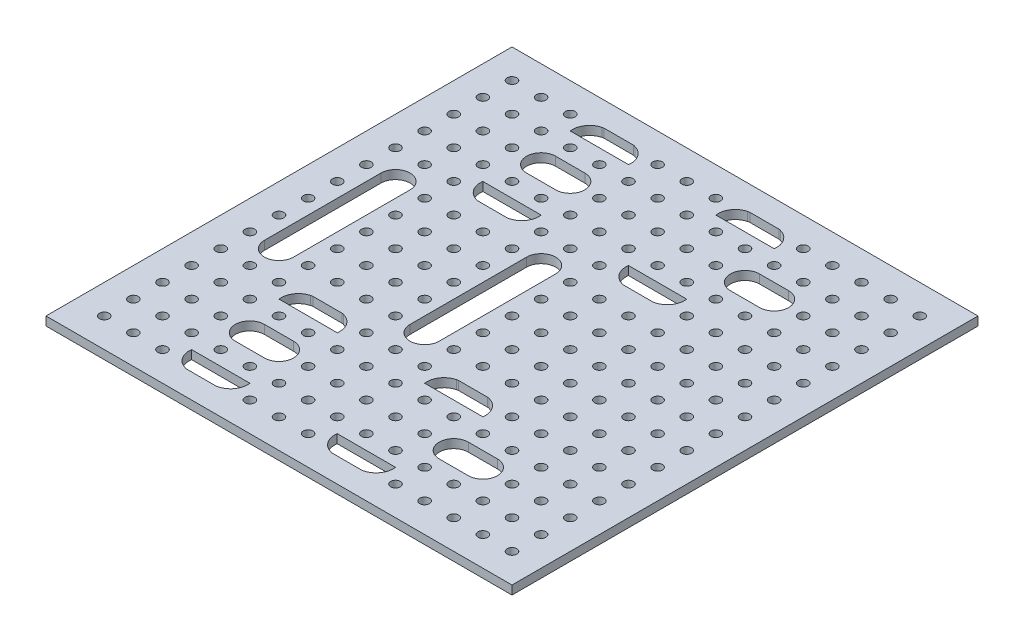
from build123d import *

# Parameters (mm, degrees)
SKETCH_1_W          = 160
SKETCH_1_H          = 160
EXTRUDE_1_DEPTH     = 3
SKETCH_3_R          = 1.65
CUT_EXTRUDE_1_DEPTH = 3
CUT_EXTRUDE_2_DEPTH = 10


with BuildPart() as part:
    # 草图1 → 凸台-拉伸1 (new body)
    with BuildSketch(Plane(origin=(0, 0, 0), x_dir=(1, 0, 0), z_dir=(0, 1, 0))):
        Rectangle(SKETCH_1_W, SKETCH_1_H)
    extrude(amount=EXTRUDE_1_DEPTH)

    # 草图3 → 切除-拉伸1 (cut)
    with BuildSketch(Plane(origin=(0, 3, 0), x_dir=(1, 0, 0), z_dir=(0, 1, 0))):
        with Locations(Location((-70, 70, 0), (0, 0, 270))):
            Circle(SKETCH_3_R)
        with Locations(Location((-60, 70, 0), (0, 0, 270))):
            Circle(SKETCH_3_R)
        with Locations(Location((-50, 70, 0), (0, 0, 270))):
            Circle(SKETCH_3_R)
        with Locations(Location((-40, 70, 0), (0, 0, 270))):
            Circle(SKETCH_3_R)
        with Locations(Location((-30, 70, 0), (0, 0, 270))):
            Circle(SKETCH_3_R)
        with Locations(Location((-20, 70, 0), (0, 0, 270))):
            Circle(SKETCH_3_R)
        with Locations(Location((-10, 70, 0), (0, 0, 270))):
            Circle(SKETCH_3_R)
        with Locations(Location((0, 70, 0), (0, 0, 270))):
            Circle(SKETCH_3_R)
        with Locations(Location((10, 70, 0), (0, 0, 270))):
            Circle(SKETCH_3_R)
        with Locations(Location((20, 70, 0), (0, 0, 270))):
            Circle(SKETCH_3_R)
        with Locations(Location((30, 70, 0), (0, 0, 270))):
            Circle(SKETCH_3_R)
        with Locations(Location((40, 70, 0), (0, 0, 270))):
            Circle(SKETCH_3_R)
        with Locations(Location((50, 70, 0), (0, 0, 270))):
            Circle(SKETCH_3_R)
        with Locations(Location((60, 70, 0), (0, 0, 270))):
            Circle(SKETCH_3_R)
        with Locations(Location((70, 70, 0), (0, 0, 270))):
            Circle(SKETCH_3_R)
        with Locations(Location((-60, 60, 0), (0, 0, 270))):
            Circle(SKETCH_3_R)
        with Locations(Location((-50, 60, 0), (0, 0, 270))):
            Circle(SKETCH_3_R)
        with Locations(Location((-40, 60, 0), (0, 0, 270))):
            Circle(SKETCH_3_R)
        with Locations(Location((-30, 60, 0), (0, 0, 270))):
            Circle(SKETCH_3_R)
        with Locations(Location((-20, 60, 0), (0, 0, 270))):
            Circle(SKETCH_3_R)
        with Locations(Location((-10, 60, 0), (0, 0, 270))):
            Circle(SKETCH_3_R)
        with Locations(Location((0, 60, 0), (0, 0, 270))):
            Circle(SKETCH_3_R)
        with Locations(Location((10, 60, 0), (0, 0, 270))):
            Circle(SKETCH_3_R)
        with Locations(Location((20, 60, 0), (0, 0, 270))):
            Circle(SKETCH_3_R)
        with Locations(Location((30, 60, 0), (0, 0, 270))):
            Circle(SKETCH_3_R)
        with Locations(Location((40, 60, 0), (0, 0, 270))):
            Circle(SKETCH_3_R)
        with Locations(Location((50, 60, 0), (0, 0, 270))):
            Circle(SKETCH_3_R)
        with Locations(Location((60, 60, 0), (0, 0, 270))):
            Circle(SKETCH_3_R)
        with Locations(Location((70, 60, 0), (0, 0, 270))):
            Circle(SKETCH_3_R)
        with Locations(Location((-60, 50, 0), (0, 0, 270))):
            Circle(SKETCH_3_R)
        with Locations(Location((-50, 50, 0), (0, 0, 270))):
            Circle(SKETCH_3_R)
        with Locations(Location((-40, 50, 0), (0, 0, 270))):
            Circle(SKETCH_3_R)
        with Locations(Location((-30, 50, 0), (0, 0, 270))):
            Circle(SKETCH_3_R)
        with Locations(Location((-20, 50, 0), (0, 0, 270))):
            Circle(SKETCH_3_R)
        with Locations(Location((-10, 50, 0), (0, 0, 270))):
            Circle(SKETCH_3_R)
        with Locations(Location((0, 50, 0), (0, 0, 270))):
            Circle(SKETCH_3_R)
        with Locations(Location((10, 50, 0), (0, 0, 270))):
            Circle(SKETCH_3_R)
        with Locations(Location((20, 50, 0), (0, 0, 270))):
            Circle(SKETCH_3_R)
        with Locations(Location((30, 50, 0), (0, 0, 270))):
            Circle(SKETCH_3_R)
        with Locations(Location((40, 50, 0), (0, 0, 270))):
            Circle(SKETCH_3_R)
        with Locations(Location((50, 50, 0), (0, 0, 270))):
            Circle(SKETCH_3_R)
        with Locations(Location((60, 50, 0), (0, 0, 270))):
            Circle(SKETCH_3_R)
        with Locations(Location((70, 50, 0), (0, 0, 270))):
            Circle(SKETCH_3_R)
        with Locations(Location((-60, 40, 0), (0, 0, 270))):
            Circle(SKETCH_3_R)
        with Locations(Location((-50, 40, 0), (0, 0, 270))):
            Circle(SKETCH_3_R)
        with Locations(Location((-40, 40, 0), (0, 0, 270))):
            Circle(SKETCH_3_R)
        with Locations(Location((-30, 40, 0), (0, 0, 270))):
            Circle(SKETCH_3_R)
        with Locations(Location((-20, 40, 0), (0, 0, 270))):
            Circle(SKETCH_3_R)
        with Locations(Location((-10, 40, 0), (0, 0, 270))):
            Circle(SKETCH_3_R)
        with Locations(Location((0, 40, 0), (0, 0, 270))):
            Circle(SKETCH_3_R)
        with Locations(Location((10, 40, 0), (0, 0, 270))):
            Circle(SKETCH_3_R)
        with Locations(Location((20, 40, 0), (0, 0, 270))):
            Circle(SKETCH_3_R)
        with Locations(Location((30, 40, 0), (0, 0, 270))):
            Circle(SKETCH_3_R)
        with Locations(Location((40, 40, 0), (0, 0, 270))):
            Circle(SKETCH_3_R)
        with Locations(Location((50, 40, 0), (0, 0, 270))):
            Circle(SKETCH_3_R)
        with Locations(Location((60, 40, 0), (0, 0, 270))):
            Circle(SKETCH_3_R)
        with Locations(Location((70, 40, 0), (0, 0, 270))):
            Circle(SKETCH_3_R)
        with Locations(Location((-60, 30, 0), (0, 0, 270))):
            Circle(SKETCH_3_R)
        with Locations(Location((-50, 30, 0), (0, 0, 270))):
            Circle(SKETCH_3_R)
        with Locations(Location((-40, 30, 0), (0, 0, 270))):
            Circle(SKETCH_3_R)
        with Locations(Location((-30, 30, 0), (0, 0, 270))):
            Circle(SKETCH_3_R)
        with Locations(Location((-20, 30, 0), (0, 0, 270))):
            Circle(SKETCH_3_R)
        with Locations(Location((-10, 30, 0), (0, 0, 270))):
            Circle(SKETCH_3_R)
        with Locations(Location((0, 30, 0), (0, 0, 270))):
            Circle(SKETCH_3_R)
        with Locations(Location((10, 30, 0), (0, 0, 270))):
            Circle(SKETCH_3_R)
        with Locations(Location((20, 30, 0), (0, 0, 270))):
            Circle(SKETCH_3_R)
        with Locations(Location((30, 30, 0), (0, 0, 270))):
            Circle(SKETCH_3_R)
        with Locations(Location((40, 30, 0), (0, 0, 270))):
            Circle(SKETCH_3_R)
        with Locations(Location((50, 30, 0), (0, 0, 270))):
            Circle(SKETCH_3_R)
        with Locations(Location((60, 30, 0), (0, 0, 270))):
            Circle(SKETCH_3_R)
        with Locations(Location((70, 30, 0), (0, 0, 270))):
            Circle(SKETCH_3_R)
        with Locations(Location((-60, 20, 0), (0, 0, 270))):
            Circle(SKETCH_3_R)
        with Locations(Location((-50, 20, 0), (0, 0, 270))):
            Circle(SKETCH_3_R)
        with Locations(Location((-40, 20, 0), (0, 0, 270))):
            Circle(SKETCH_3_R)
        with Locations(Location((-30, 20, 0), (0, 0, 270))):
            Circle(SKETCH_3_R)
        with Locations(Location((-20, 20, 0), (0, 0, 270))):
            Circle(SKETCH_3_R)
        with Locations(Location((-10, 20, 0), (0, 0, 270))):
            Circle(SKETCH_3_R)
        with Locations(Location((0, 20, 0), (0, 0, 270))):
            Circle(SKETCH_3_R)
        with Locations(Location((10, 20, 0), (0, 0, 270))):
            Circle(SKETCH_3_R)
        with Locations(Location((20, 20, 0), (0, 0, 270))):
            Circle(SKETCH_3_R)
        with Locations(Location((30, 20, 0), (0, 0, 270))):
            Circle(SKETCH_3_R)
        with Locations(Location((40, 20, 0), (0, 0, 270))):
            Circle(SKETCH_3_R)
        with Locations(Location((50, 20, 0), (0, 0, 270))):
            Circle(SKETCH_3_R)
        with Locations(Location((60, 20, 0), (0, 0, 270))):
            Circle(SKETCH_3_R)
        with Locations(Location((70, 20, 0), (0, 0, 270))):
            Circle(SKETCH_3_R)
        with Locations(Location((-60, 10, 0), (0, 0, 270))):
            Circle(SKETCH_3_R)
        with Locations(Location((-50, 10, 0), (0, 0, 270))):
            Circle(SKETCH_3_R)
        with Locations(Location((-40, 10, 0), (0, 0, 270))):
            Circle(SKETCH_3_R)
        with Locations(Location((-30, 10, 0), (0, 0, 270))):
            Circle(SKETCH_3_R)
        with Locations(Location((-20, 10, 0), (0, 0, 270))):
            Circle(SKETCH_3_R)
        with Locations(Location((-10, 10, 0), (0, 0, 270))):
            Circle(SKETCH_3_R)
        with Locations(Location((0, 10, 0), (0, 0, 270))):
            Circle(SKETCH_3_R)
        with Locations(Location((10, 10, 0), (0, 0, 270))):
            Circle(SKETCH_3_R)
        with Locations(Location((20, 10, 0), (0, 0, 270))):
            Circle(SKETCH_3_R)
        with Locations(Location((30, 10, 0), (0, 0, 270))):
            Circle(SKETCH_3_R)
        with Locations(Location((40, 10, 0), (0, 0, 270))):
            Circle(SKETCH_3_R)
        with Locations(Location((50, 10, 0), (0, 0, 270))):
            Circle(SKETCH_3_R)
        with Locations(Location((60, 10, 0), (0, 0, 270))):
            Circle(SKETCH_3_R)
        with Locations(Location((70, 10, 0), (0, 0, 270))):
            Circle(SKETCH_3_R)
        with Locations(Location((-60, 0, 0), (0, 0, 270))):
            Circle(SKETCH_3_R)
        with Locations(Location((-50, 0, 0), (0, 0, 270))):
            Circle(SKETCH_3_R)
        with Locations(Location((-40, 0, 0), (0, 0, 270))):
            Circle(SKETCH_3_R)
        with Locations(Location((-30, 0, 0), (0, 0, 270))):
            Circle(SKETCH_3_R)
        with Locations(Location((-20, 0, 0), (0, 0, 270))):
            Circle(SKETCH_3_R)
        with Locations(Location((-10, 0, 0), (0, 0, 270))):
            Circle(SKETCH_3_R)
        with Locations(Location((0, 0, 0), (0, 0, 270))):
            Circle(SKETCH_3_R)
        with Locations(Location((10, 0, 0), (0, 0, 270))):
            Circle(SKETCH_3_R)
        with Locations(Location((20, 0, 0), (0, 0, 270))):
            Circle(SKETCH_3_R)
        with Locations(Location((30, 0, 0), (0, 0, 270))):
            Circle(SKETCH_3_R)
        with Locations(Location((40, 0, 0), (0, 0, 270))):
            Circle(SKETCH_3_R)
        with Locations(Location((50, 0, 0), (0, 0, 270))):
            Circle(SKETCH_3_R)
        with Locations(Location((60, 0, 0), (0, 0, 270))):
            Circle(SKETCH_3_R)
        with Locations(Location((70, 0, 0), (0, 0, 270))):
            Circle(SKETCH_3_R)
        with Locations(Location((-60, -10, 0), (0, 0, 270))):
            Circle(SKETCH_3_R)
        with Locations(Location((-50, -10, 0), (0, 0, 270))):
            Circle(SKETCH_3_R)
        with Locations(Location((-40, -10, 0), (0, 0, 270))):
            Circle(SKETCH_3_R)
        with Locations(Location((-30, -10, 0), (0, 0, 270))):
            Circle(SKETCH_3_R)
        with Locations(Location((-20, -10, 0), (0, 0, 270))):
            Circle(SKETCH_3_R)
        with Locations(Location((-10, -10, 0), (0, 0, 270))):
            Circle(SKETCH_3_R)
        with Locations(Location((0, -10, 0), (0, 0, 270))):
            Circle(SKETCH_3_R)
        with Locations(Location((10, -10, 0), (0, 0, 270))):
            Circle(SKETCH_3_R)
        with Locations(Location((20, -10, 0), (0, 0, 270))):
            Circle(SKETCH_3_R)
        with Locations(Location((30, -10, 0), (0, 0, 270))):
            Circle(SKETCH_3_R)
        with Locations(Location((40, -10, 0), (0, 0, 270))):
            Circle(SKETCH_3_R)
        with Locations(Location((50, -10, 0), (0, 0, 270))):
            Circle(SKETCH_3_R)
        with Locations(Location((60, -10, 0), (0, 0, 270))):
            Circle(SKETCH_3_R)
        with Locations(Location((70, -10, 0), (0, 0, 270))):
            Circle(SKETCH_3_R)
        with Locations(Location((-60, -20, 0), (0, 0, 270))):
            Circle(SKETCH_3_R)
        with Locations(Location((-50, -20, 0), (0, 0, 270))):
            Circle(SKETCH_3_R)
        with Locations(Location((-40, -20, 0), (0, 0, 270))):
            Circle(SKETCH_3_R)
        with Locations(Location((-30, -20, 0), (0, 0, 270))):
            Circle(SKETCH_3_R)
        with Locations(Location((-20, -20, 0), (0, 0, 270))):
            Circle(SKETCH_3_R)
        with Locations(Location((-10, -20, 0), (0, 0, 270))):
            Circle(SKETCH_3_R)
        with Locations(Location((0, -20, 0), (0, 0, 270))):
            Circle(SKETCH_3_R)
        with Locations(Location((10, -20, 0), (0, 0, 270))):
            Circle(SKETCH_3_R)
        with Locations(Location((20, -20, 0), (0, 0, 270))):
            Circle(SKETCH_3_R)
        with Locations(Location((30, -20, 0), (0, 0, 270))):
            Circle(SKETCH_3_R)
        with Locations(Location((40, -20, 0), (0, 0, 270))):
            Circle(SKETCH_3_R)
        with Locations(Location((50, -20, 0), (0, 0, 270))):
            Circle(SKETCH_3_R)
        with Locations(Location((60, -20, 0), (0, 0, 270))):
            Circle(SKETCH_3_R)
        with Locations(Location((70, -20, 0), (0, 0, 270))):
            Circle(SKETCH_3_R)
        with Locations(Location((-60, -30, 0), (0, 0, 270))):
            Circle(SKETCH_3_R)
        with Locations(Location((-50, -30, 0), (0, 0, 270))):
            Circle(SKETCH_3_R)
        with Locations(Location((-40, -30, 0), (0, 0, 270))):
            Circle(SKETCH_3_R)
        with Locations(Location((-30, -30, 0), (0, 0, 270))):
            Circle(SKETCH_3_R)
        with Locations(Location((-20, -30, 0), (0, 0, 270))):
            Circle(SKETCH_3_R)
        with Locations(Location((-10, -30, 0), (0, 0, 270))):
            Circle(SKETCH_3_R)
        with Locations(Location((0, -30, 0), (0, 0, 270))):
            Circle(SKETCH_3_R)
        with Locations(Location((10, -30, 0), (0, 0, 270))):
            Circle(SKETCH_3_R)
        with Locations(Location((20, -30, 0), (0, 0, 270))):
            Circle(SKETCH_3_R)
        with Locations(Location((30, -30, 0), (0, 0, 270))):
            Circle(SKETCH_3_R)
        with Locations(Location((40, -30, 0), (0, 0, 270))):
            Circle(SKETCH_3_R)
        with Locations(Location((50, -30, 0), (0, 0, 270))):
            Circle(SKETCH_3_R)
        with Locations(Location((60, -30, 0), (0, 0, 270))):
            Circle(SKETCH_3_R)
        with Locations(Location((70, -30, 0), (0, 0, 270))):
            Circle(SKETCH_3_R)
        with Locations(Location((-60, -40, 0), (0, 0, 270))):
            Circle(SKETCH_3_R)
        with Locations(Location((-50, -40, 0), (0, 0, 270))):
            Circle(SKETCH_3_R)
        with Locations(Location((-40, -40, 0), (0, 0, 270))):
            Circle(SKETCH_3_R)
        with Locations(Location((-30, -40, 0), (0, 0, 270))):
            Circle(SKETCH_3_R)
        with Locations(Location((-20, -40, 0), (0, 0, 270))):
            Circle(SKETCH_3_R)
        with Locations(Location((-10, -40, 0), (0, 0, 270))):
            Circle(SKETCH_3_R)
        with Locations(Location((0, -40, 0), (0, 0, 270))):
            Circle(SKETCH_3_R)
        with Locations(Location((10, -40, 0), (0, 0, 270))):
            Circle(SKETCH_3_R)
        with Locations(Location((20, -40, 0), (0, 0, 270))):
            Circle(SKETCH_3_R)
        with Locations(Location((30, -40, 0), (0, 0, 270))):
            Circle(SKETCH_3_R)
        with Locations(Location((40, -40, 0), (0, 0, 270))):
            Circle(SKETCH_3_R)
        with Locations(Location((50, -40, 0), (0, 0, 270))):
            Circle(SKETCH_3_R)
        with Locations(Location((60, -40, 0), (0, 0, 270))):
            Circle(SKETCH_3_R)
        with Locations(Location((70, -40, 0), (0, 0, 270))):
            Circle(SKETCH_3_R)
        with Locations(Location((-60, -50, 0), (0, 0, 270))):
            Circle(SKETCH_3_R)
        with Locations(Location((-50, -50, 0), (0, 0, 270))):
            Circle(SKETCH_3_R)
        with Locations(Location((-40, -50, 0), (0, 0, 270))):
            Circle(SKETCH_3_R)
        with Locations(Location((-30, -50, 0), (0, 0, 270))):
            Circle(SKETCH_3_R)
        with Locations(Location((-20, -50, 0), (0, 0, 270))):
            Circle(SKETCH_3_R)
        with Locations(Location((-10, -50, 0), (0, 0, 270))):
            Circle(SKETCH_3_R)
        with Locations(Location((0, -50, 0), (0, 0, 270))):
            Circle(SKETCH_3_R)
        with Locations(Location((10, -50, 0), (0, 0, 270))):
            Circle(SKETCH_3_R)
        with Locations(Location((20, -50, 0), (0, 0, 270))):
            Circle(SKETCH_3_R)
        with Locations(Location((30, -50, 0), (0, 0, 270))):
            Circle(SKETCH_3_R)
        with Locations(Location((40, -50, 0), (0, 0, 270))):
            Circle(SKETCH_3_R)
        with Locations(Location((50, -50, 0), (0, 0, 270))):
            Circle(SKETCH_3_R)
        with Locations(Location((60, -50, 0), (0, 0, 270))):
            Circle(SKETCH_3_R)
        with Locations(Location((70, -50, 0), (0, 0, 270))):
            Circle(SKETCH_3_R)
        with Locations(Location((-60, -60, 0), (0, 0, 270))):
            Circle(SKETCH_3_R)
        with Locations(Location((-50, -60, 0), (0, 0, 270))):
            Circle(SKETCH_3_R)
        with Locations(Location((-40, -60, 0), (0, 0, 270))):
            Circle(SKETCH_3_R)
        with Locations(Location((-30, -60, 0), (0, 0, 270))):
            Circle(SKETCH_3_R)
        with Locations(Location((-20, -60, 0), (0, 0, 270))):
            Circle(SKETCH_3_R)
        with Locations(Location((-10, -60, 0), (0, 0, 270))):
            Circle(SKETCH_3_R)
        with Locations(Location((0, -60, 0), (0, 0, 270))):
            Circle(SKETCH_3_R)
        with Locations(Location((10, -60, 0), (0, 0, 270))):
            Circle(SKETCH_3_R)
        with Locations(Location((20, -60, 0), (0, 0, 270))):
            Circle(SKETCH_3_R)
        with Locations(Location((30, -60, 0), (0, 0, 270))):
            Circle(SKETCH_3_R)
        with Locations(Location((40, -60, 0), (0, 0, 270))):
            Circle(SKETCH_3_R)
        with Locations(Location((50, -60, 0), (0, 0, 270))):
            Circle(SKETCH_3_R)
        with Locations(Location((60, -60, 0), (0, 0, 270))):
            Circle(SKETCH_3_R)
        with Locations(Location((70, -60, 0), (0, 0, 270))):
            Circle(SKETCH_3_R)
        with Locations(Location((-60, -70, 0), (0, 0, 270))):
            Circle(SKETCH_3_R)
        with Locations(Location((-50, -70, 0), (0, 0, 270))):
            Circle(SKETCH_3_R)
        with Locations(Location((-40, -70, 0), (0, 0, 270))):
            Circle(SKETCH_3_R)
        with Locations(Location((-30, -70, 0), (0, 0, 270))):
            Circle(SKETCH_3_R)
        with Locations(Location((-20, -70, 0), (0, 0, 270))):
            Circle(SKETCH_3_R)
        with Locations(Location((-10, -70, 0), (0, 0, 270))):
            Circle(SKETCH_3_R)
        with Locations(Location((0, -70, 0), (0, 0, 270))):
            Circle(SKETCH_3_R)
        with Locations(Location((10, -70, 0), (0, 0, 270))):
            Circle(SKETCH_3_R)
        with Locations(Location((20, -70, 0), (0, 0, 270))):
            Circle(SKETCH_3_R)
        with Locations(Location((30, -70, 0), (0, 0, 270))):
            Circle(SKETCH_3_R)
        with Locations(Location((40, -70, 0), (0, 0, 270))):
            Circle(SKETCH_3_R)
        with Locations(Location((50, -70, 0), (0, 0, 270))):
            Circle(SKETCH_3_R)
        with Locations(Location((60, -70, 0), (0, 0, 270))):
            Circle(SKETCH_3_R)
        with Locations(Location((70, -70, 0), (0, 0, 270))):
            Circle(SKETCH_3_R)
        with Locations(Location((-70, 60, 0), (0, 0, 270))):
            Circle(SKETCH_3_R)
        with Locations(Location((-70, 50, 0), (0, 0, 270))):
            Circle(SKETCH_3_R)
        with Locations(Location((-70, 40, 0), (0, 0, 270))):
            Circle(SKETCH_3_R)
        with Locations(Location((-70, 30, 0), (0, 0, 270))):
            Circle(SKETCH_3_R)
        with Locations(Location((-70, 20, 0), (0, 0, 270))):
            Circle(SKETCH_3_R)
        with Locations(Location((-70, 10, 0), (0, 0, 270))):
            Circle(SKETCH_3_R)
        with Locations(Location((-70, 0, 0), (0, 0, 270))):
            Circle(SKETCH_3_R)
        with Locations(Location((-70, -10, 0), (0, 0, 270))):
            Circle(SKETCH_3_R)
        with Locations(Location((-70, -20, 0), (0, 0, 270))):
            Circle(SKETCH_3_R)
        with Locations(Location((-70, -30, 0), (0, 0, 270))):
            Circle(SKETCH_3_R)
        with Locations(Location((-70, -40, 0), (0, 0, 270))):
            Circle(SKETCH_3_R)
        with Locations(Location((-70, -50, 0), (0, 0, 270))):
            Circle(SKETCH_3_R)
        with Locations(Location((-70, -60, 0), (0, 0, 270))):
            Circle(SKETCH_3_R)
        with Locations(Location((-70, -70, 0), (0, 0, 270))):
            Circle(SKETCH_3_R)
    extrude(amount=-CUT_EXTRUDE_1_DEPTH, mode=Mode.SUBTRACT)

    # 草图4 → 切除-拉伸2 (cut)
    with BuildSketch(Plane(origin=(0, 3, 0), x_dir=(1, 0, 0), z_dir=(0, 1, 0))):
        with BuildLine():
            Line((30, -45), (40, -45))
            ThreePointArc((40, -45), (45, -50), (40, -55))
            Line((40, -55), (30, -55))
            ThreePointArc((30, -55), (25, -50), (30, -45))
        make_face()
        with BuildLine():
            Line((-40, -45), (-30, -45))
            ThreePointArc((-30, -45), (-25, -50), (-30, -55))
            Line((-30, -55), (-40, -55))
            ThreePointArc((-40, -55), (-45, -50), (-40, -45))
        make_face()
        with BuildLine():
            Line((-40, 55), (-30, 55))
            ThreePointArc((-30, 55), (-25, 50), (-30, 45))
            Line((-30, 45), (-40, 45))
            ThreePointArc((-40, 45), (-45, 50), (-40, 55))
        make_face()
        with BuildLine():
            Line((30, 55), (40, 55))
            ThreePointArc((40, 55), (45, 50), (40, 45))
            Line((40, 45), (30, 45))
            ThreePointArc((30, 45), (25, 50), (30, 55))
        make_face()
        with BuildLine():
            Line((-55, 20), (-55, -20))
            ThreePointArc((-55, -20), (-60, -25), (-65, -20))
            Line((-65, -20), (-65, 20))
            ThreePointArc((-65, 20), (-60, 25), (-55, 20))
        make_face()
        with BuildLine():
            Line((-5, 20), (-5, -20))
            ThreePointArc((-5, -20), (-10, -25), (-15, -20))
            Line((-15, -20), (-15, 20))
            ThreePointArc((-15, 20), (-10, 25), (-5, 20))
        make_face()
        with BuildLine():
            Line((20, 71.65), (10, 71.65))
            ThreePointArc((10, 71.65), (6.122739905, 69.360533906), (5, 65))
            Line((5, 65), (25, 65))
            ThreePointArc((25, 65), (23.877260095, 69.360533906), (20, 71.65))
        make_face()
        with BuildLine():
            Line((-30, 71.65), (-40, 71.65))
            ThreePointArc((-40, 71.65), (-43.877260095, 69.360533906), (-45, 65))
            Line((-45, 65), (-25, 65))
            ThreePointArc((-25, 65), (-26.122739905, 69.360533906), (-30, 71.65))
        make_face()
        with BuildLine():
            Line((25, 35), (5, 35))
            ThreePointArc((5, 35), (6.122739905, 30.639466094), (10, 28.35))
            Line((10, 28.35), (20, 28.35))
            ThreePointArc((20, 28.35), (23.877260095, 30.639466094), (25, 35))
        make_face()
        with BuildLine():
            Line((-25, 35), (-45, 35))
            ThreePointArc((-45, 35), (-43.877260095, 30.639466094), (-40, 28.35))
            Line((-40, 28.35), (-30, 28.35))
            ThreePointArc((-30, 28.35), (-26.122739905, 30.639466094), (-25, 35))
        make_face()
        with BuildLine():
            Line((-25, -65), (-45, -65))
            ThreePointArc((-45, -65), (-43.877260095, -69.360533906), (-40, -71.65))
            Line((-40, -71.65), (-30, -71.65))
            ThreePointArc((-30, -71.65), (-26.122739905, -69.360533906), (-25, -65))
        make_face()
        with BuildLine():
            Line((-25, -35), (-45, -35))
            ThreePointArc((-45, -35), (-43.877260095, -30.639466094), (-40, -28.35))
            Line((-40, -28.35), (-30, -28.35))
            ThreePointArc((-30, -28.35), (-26.122739905, -30.639466094), (-25, -35))
        make_face()
        with BuildLine():
            Line((25, -35), (5, -35))
            ThreePointArc((5, -35), (6.122739905, -30.639466094), (10, -28.35))
            Line((10, -28.35), (20, -28.35))
            ThreePointArc((20, -28.35), (23.877260095, -30.639466094), (25, -35))
        make_face()
        with BuildLine():
            Line((25, -65), (5, -65))
            ThreePointArc((5, -65), (6.122739905, -69.360533906), (10, -71.65))
            Line((10, -71.65), (20, -71.65))
            ThreePointArc((20, -71.65), (23.877260095, -69.360533906), (25, -65))
        make_face()
    extrude(amount=-CUT_EXTRUDE_2_DEPTH, mode=Mode.SUBTRACT)


solid = part.part
